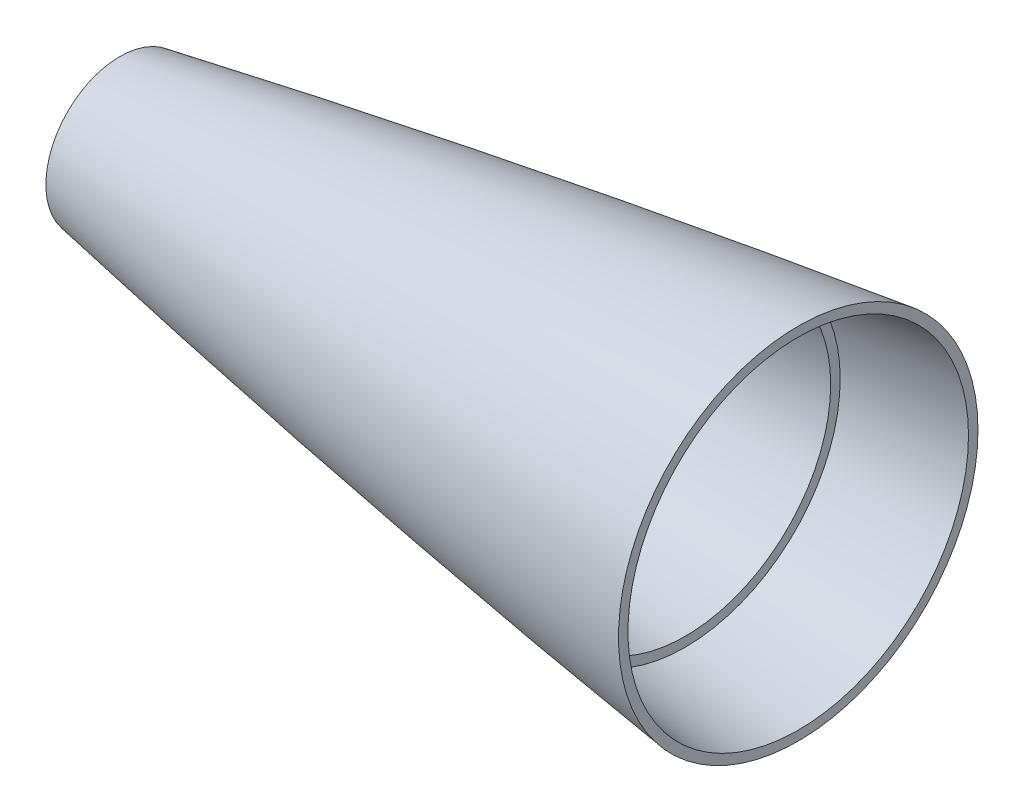
from build123d import *


with BuildPart() as part:
    # Sketch1 → Revolve1 (revolve)
    with BuildSketch(Plane.XY, mode=Mode.PRIVATE) as revolve1_sk:
        with BuildLine():
            Line((-470, 3602.469847202), (-470, 3604.991019406))
            ThreePointArc((-470, 3604.991019406), (-560.175855014, 3592.083415159), (-650, 3576.920498138))
            Line((-650, 3576.920498138), (-650, 3571.838497189))
            Line((-650, 3571.838497189), (-600, 3571.838497189))
            Line((-600, 3571.838497189), (-600, 3580.576804092))
            ThreePointArc((-600, 3580.576804092), (-550.053393511, 3588.589070134), (-499.999999999, 3595.904649737))
            Line((-499.999999999, 3595.904649737), (-499.999999999, 3598.125802414))
            Line((-499.999999999, 3598.125802414), (-499.999999999, 3598.428684857))
            ThreePointArc((-499.999999999, 3598.428684857), (-485.004209, 3600.480511995), (-470, 3602.469847202))
        make_face()
    revolve(revolve1_sk.sketch.rotate(Axis((0, 3557.296761587, 0), (-1, 0, 0)), 90), axis=Axis((0, 3557.296761587, 0), (-1, 0, 0)))


solid = part.part
